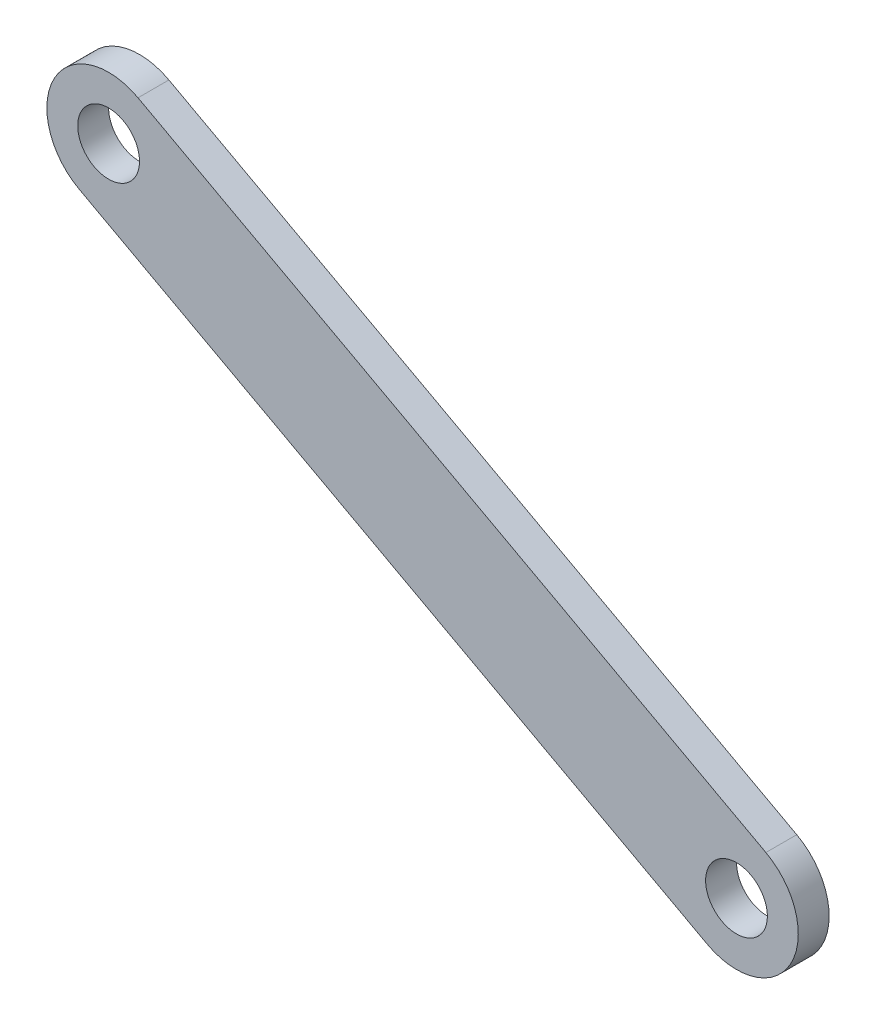
from build123d import *

# Parameters (mm, degrees)
BOSS_EXTRUDE1_START = -1.5875
SKETCH1_R           = 1.5875
BOSS_EXTRUDE1_DEPTH = 1.5875


with BuildPart() as part:
    # Sketch1 → Boss-Extrude1 (new body)
    with BuildSketch(Plane.XY.offset(BOSS_EXTRUDE1_START)):
        with BuildLine():
            Line((-57.720817092, -25.260365648), (-25.441409162, -42.722605588))
            ThreePointArc((-25.441409162, -42.722605588), (-24.159542449, -47.025868039), (-28.462804901, -48.307734753))
            Line((-28.462804901, -48.307734753), (-60.742212831, -30.845494813))
            ThreePointArc((-60.742212831, -30.845494813), (-62.024079544, -26.542232361), (-57.720817092, -25.260365648))
        make_face()
        with Locations((-26.952107032, -45.51517017)):
            Circle(SKETCH1_R, mode=Mode.SUBTRACT)
        with Locations((-59.231514961, -28.052930231)):
            Circle(SKETCH1_R, mode=Mode.SUBTRACT)
    extrude(amount=BOSS_EXTRUDE1_DEPTH)


solid = part.part
